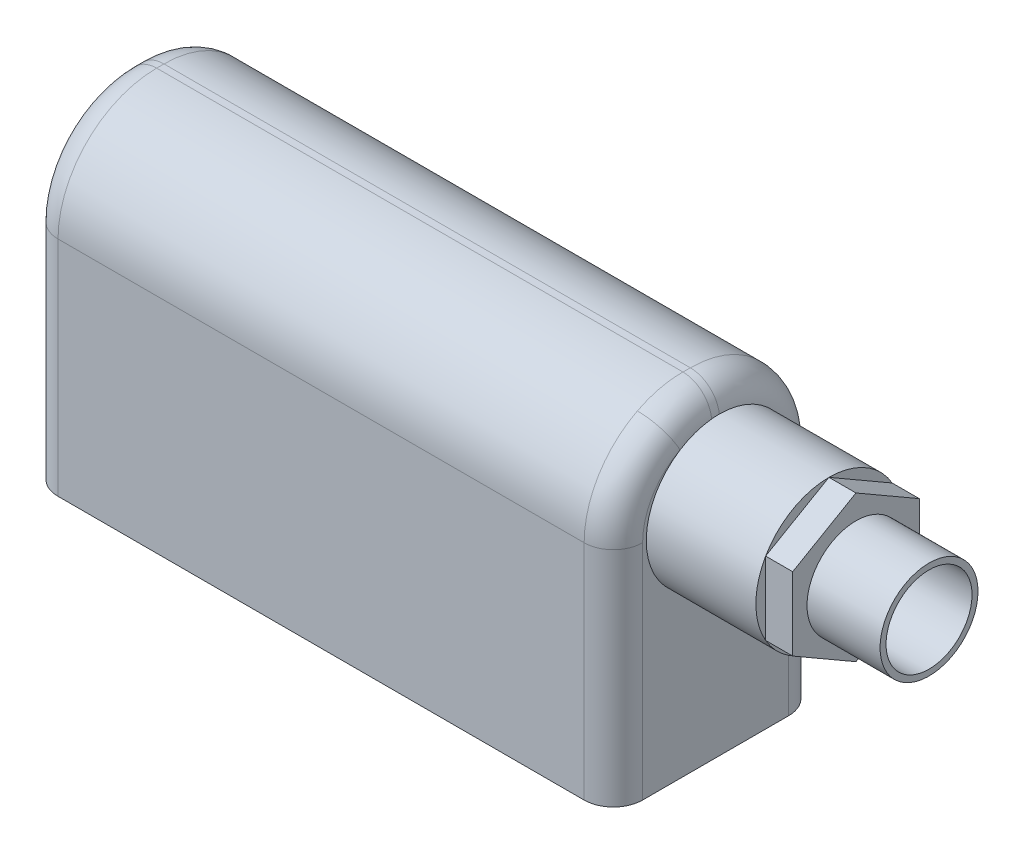
from build123d import *

# Parameters (mm, degrees)
SKETCH_1_W          = 80
SKETCH_1_H          = 44
EXTRUDE_1_DEPTH     = 28
FILLET_1_R          = 13.5
FILLET_2_R          = 13.5
SKETCH_2_R          = 10
EXTRUDE_2_DEPTH     = 15
EXTRUDE_3_DEPTH     = 3.7
SKETCH_4_R          = 6.7
EXTRUDE_4_DEPTH     = 10
SKETCH_5_R          = 5.883118282
CUT_EXTRUDE_1_DEPTH = 20
FILLET_3_R          = 4
CUT_EXTRUDE_2_DEPTH = 8.5
EXTRUDE_5_DEPTH     = 14
FILLET_4_R          = 3
FILLET_5_R          = 3
SKETCH_9_R          = 1.5
CUT_EXTRUDE_3_DEPTH = 4


with BuildPart() as part:
    # 草图1 → 凸台-拉伸1 (new body)
    with BuildSketch(Plane.XY):
        Rectangle(SKETCH_1_W, SKETCH_1_H)
    extrude(amount=EXTRUDE_1_DEPTH)

    # 圆角1
    fillet_1_edges = [part.edges().sort_by_distance(p)[0] for p in [
        (0, 22, 28),
    ]]
    fillet(fillet_1_edges, radius=FILLET_1_R)

    # 圆角2
    fillet_2_edges = [part.edges().sort_by_distance(p)[0] for p in [
        (0, 22, 0),
    ]]
    fillet(fillet_2_edges, radius=FILLET_2_R)

    # 草图2 → 凸台-拉伸2 (add)
    with BuildSketch(Plane(origin=(40, 0, 0), x_dir=(0, 0, -1), z_dir=(1, 0, 0))):
        with Locations((-13.5, 8.5)):
            Circle(SKETCH_2_R)
    extrude(amount=EXTRUDE_2_DEPTH)

    # 草图3 → 凸台-拉伸3 (add)
    with BuildSketch(Plane(origin=(55, 0, 0), x_dir=(0, 0, -1), z_dir=(1, 0, 0))):
        Polygon((-13.5, 18.5), (-22.160254038, 13.5), (-22.160254038, 3.5), (-13.5, -1.5), (-4.839745962, 3.5), (-4.839745962, 13.5), align=None)
    extrude(amount=EXTRUDE_3_DEPTH)

    # 草图4 → 凸台-拉伸4 (add)
    with BuildSketch(Plane(origin=(58.7, 0, 0), x_dir=(0, 0, -1), z_dir=(1, 0, 0))):
        with Locations((-13.5, 8.5)):
            Circle(SKETCH_4_R)
    extrude(amount=EXTRUDE_4_DEPTH)

    # 草图5 → 切除-拉伸1 (cut)
    with BuildSketch(Plane(origin=(68.7, 0, 0), x_dir=(0, 0, -1), z_dir=(1, 0, 0))):
        with Locations((-13.5, 8.5)):
            Circle(SKETCH_5_R)
    extrude(amount=-CUT_EXTRUDE_1_DEPTH, mode=Mode.SUBTRACT)

    # 圆角3
    fillet_3_edges = [part.edges().sort_by_distance(p)[0] for p in [
        (40, -6.75, 0),
        (40, 18.045941546, 24.045941546),
        (-40, -6.75, 0),
        (-40, 18.045941546, 3.954058454),
        (-40, 22, 14),
        (-40, 18.045941546, 24.045941546),
        (40, -6.75, 28),
        (-40, -6.75, 28),
    ]]
    fillet(fillet_3_edges, radius=FILLET_3_R)

    # 草图7 → 切除-拉伸2 (cut)
    with BuildSketch(Plane.XZ.offset(22)):
        with BuildLine():
            Line((-36, 2), (36, 2))
            ThreePointArc((36, 2), (37.414213562, 2.585786438), (38, 4))
            Line((38, 4), (38, 24))
            ThreePointArc((38, 24), (37.414213562, 25.414213562), (36, 26))
            Line((36, 26), (-36, 26))
            ThreePointArc((-36, 26), (-37.414213562, 25.414213562), (-38, 24))
            Line((-38, 24), (-38, 4))
            ThreePointArc((-38, 4), (-37.414213562, 2.585786438), (-36, 2))
        make_face()
    extrude(amount=-CUT_EXTRUDE_2_DEPTH, mode=Mode.SUBTRACT)

    # 草图8 → 凸台-拉伸5 (add)
    with BuildSketch(Plane.XZ.offset(13.5)):
        Polygon((-18, 16), (-18, 20), (18, 20), (18, 16), (22.5, 16), (22.5, 12), (18, 12), (18, 8), (-18, 8), (-18, 12), (-22.5, 12), (-22.5, 16), align=None)
    extrude(amount=EXTRUDE_5_DEPTH)

    # 圆角4
    fillet_4_edges = [part.edges().sort_by_distance(p)[0] for p in [
        (0, -27.5, 20),
    ]]
    fillet(fillet_4_edges, radius=FILLET_4_R)

    # 圆角5
    fillet_5_edges = [part.edges().sort_by_distance(p)[0] for p in [
        (0, -27.5, 8),
    ]]
    fillet(fillet_5_edges, radius=FILLET_5_R)

    # 草图9 → 切除-拉伸3 (cut)
    with BuildSketch(Plane.XZ.offset(13.5)):
        with Locations((-24.3, 20)):
            Circle(SKETCH_9_R)
        with Locations((-18.9, 20)):
            Circle(SKETCH_9_R)
        with Locations((-13.5, 20)):
            Circle(SKETCH_9_R)
        with Locations((-8.1, 20)):
            Circle(SKETCH_9_R)
        with Locations((-2.7, 20)):
            Circle(SKETCH_9_R)
        with Locations((2.7, 20)):
            Circle(SKETCH_9_R)
        with Locations((8.1, 20)):
            Circle(SKETCH_9_R)
        with Locations((13.5, 20)):
            Circle(SKETCH_9_R)
        with Locations((18.9, 20)):
            Circle(SKETCH_9_R)
        with Locations((24.3, 20)):
            Circle(SKETCH_9_R)
        with Locations((-24.3, 8)):
            Circle(SKETCH_9_R)
        with Locations((-18.9, 8)):
            Circle(SKETCH_9_R)
        with Locations((-13.5, 8)):
            Circle(SKETCH_9_R)
        with Locations((-8.1, 8)):
            Circle(SKETCH_9_R)
        with Locations((-2.7, 8)):
            Circle(SKETCH_9_R)
        with Locations((2.7, 8)):
            Circle(SKETCH_9_R)
        with Locations((8.1, 8)):
            Circle(SKETCH_9_R)
        with Locations((13.5, 8)):
            Circle(SKETCH_9_R)
        with Locations((18.9, 8)):
            Circle(SKETCH_9_R)
        with Locations((24.3, 8)):
            Circle(SKETCH_9_R)
    extrude(amount=-CUT_EXTRUDE_3_DEPTH, mode=Mode.SUBTRACT)


solid = part.part
